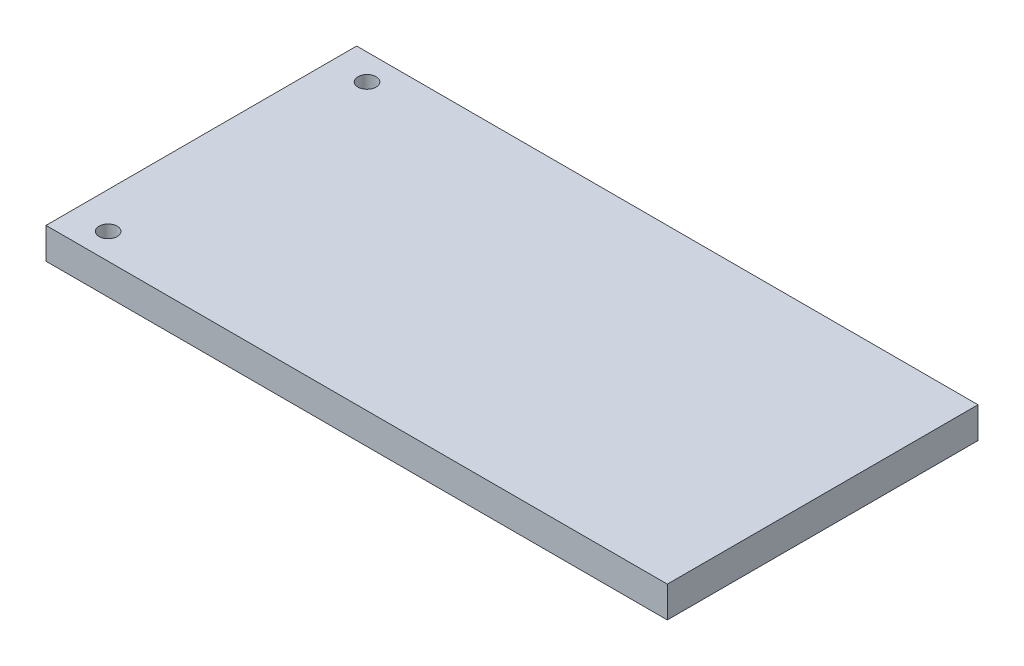
from build123d import *

# Parameters (mm, degrees)
EXTRUDE_1_DEPTH     = 6
CUT_EXTRUDE_1_DEPTH = 6


with BuildPart() as part:
    # 草图1 → 凸台-拉伸1 (new body)
    with BuildSketch(Plane(origin=(0, 0, 0), x_dir=(1, 0, 0), z_dir=(0, 1, 0))):
        Polygon((0, 0), (-60, 0), (-60, -60), (60, -60), (60, 0), align=None)
    extrude(amount=EXTRUDE_1_DEPTH)

    # 草图2 → 切除-拉伸1 (cut)
    with BuildSketch(Plane(origin=(0, 6, 0), x_dir=(1, 0, 0), z_dir=(0, 1, 0))):
        with BuildLine():
            ThreePointArc((-51.25, -5), (-51.762563133, -3.762563133), (-53, -3.25))
            Line((-53, -3.25), (-53, -5))
            Line((-53, -5), (-53, -6.75))
            ThreePointArc((-53, -6.75), (-51.762563133, -6.237436867), (-51.25, -5))
        make_face()
        with BuildLine():
            Line((-53, -5), (-53, -3.25))
            ThreePointArc((-53, -3.25), (-54.75, -5), (-53, -6.75))
            Line((-53, -6.75), (-53, -5))
        make_face()
        with BuildLine():
            ThreePointArc((-51.25, -55), (-51.762563133, -53.762563133), (-53, -53.25))
            Line((-53, -53.25), (-53, -55))
            Line((-53, -55), (-53, -56.75))
            ThreePointArc((-53, -56.75), (-51.762563133, -56.237436867), (-51.25, -55))
        make_face()
        with BuildLine():
            Line((-53, -55), (-53, -53.25))
            ThreePointArc((-53, -53.25), (-54.75, -55), (-53, -56.75))
            Line((-53, -56.75), (-53, -55))
        make_face()
    extrude(amount=-CUT_EXTRUDE_1_DEPTH, mode=Mode.SUBTRACT)


solid = part.part
